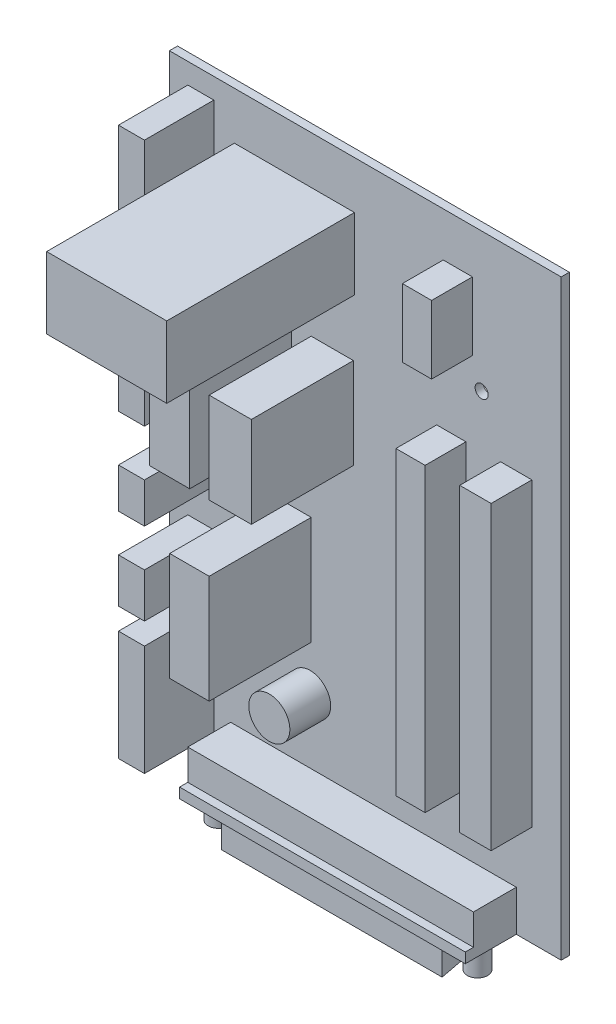
from build123d import *

# Parameters (mm, degrees)
SKETCH_1_W          = 96
SKETCH_1_H          = 145
EXTRUDE_1_DEPTH     = 2
SKETCH_2_W          = 6.362526911
SKETCH_2_H          = 29.426686961
SKETCH_2_H_2        = 22.799054763
SKETCH_2_H_3        = 9.808895654
SKETCH_2_H_4        = 10.869316806
SKETCH_2_H_5        = 27.04073937
EXTRUDE_2_DEPTH     = 17
SKETCH_3_W          = 29.426686961
SKETCH_3_H          = 17.496949003
EXTRUDE_3_DEPTH     = 46
SKETCH_4_W          = 9.808895653
SKETCH_4_H          = 22.268844187
SKETCH_4_W_2        = 10.33910623
SKETCH_4_W_3        = 9.676343009
SKETCH_4_H_2        = 26.510528793
EXTRUDE_4_DEPTH     = 25
SKETCH_5_R          = 5.037000471
EXTRUDE_5_DEPTH     = 10
SKETCH_6_W          = 7.157842775
SKETCH_6_H          = 16.70163314
EXTRUDE_6_DEPTH     = 10
SKETCH_7_W          = 7.157842774
SKETCH_7_H          = 73.699270047
SKETCH_7_W_2        = 7.68805335
EXTRUDE_7_DEPTH     = 10
SKETCH_8_R          = 1.6
CUT_EXTRUDE_1_DEPTH = 99.367931766
SKETCH_9_W          = 70
SKETCH_9_H          = 10
EXTRUDE_8_DEPTH     = 10.5
SKETCH_10_W         = 70
SKETCH_10_H         = 2.5
EXTRUDE_9_DEPTH     = 2
EXTRUDE_10_DEPTH    = 8
SKETCH_12_R         = 2.5
EXTRUDE_11_DEPTH    = 6
M3X0_5_1_D          = 2.5
M3X0_5_1_DEPTH      = 7.5
M3X0_5_1_TIP        = 0.751075774


with BuildPart() as part:
    # 草图1 → 凸台-拉伸1 (new body)
    with BuildSketch(Plane.XY):
        Rectangle(SKETCH_1_W, SKETCH_1_H)
    extrude(amount=EXTRUDE_1_DEPTH)

    # 草图2 → 凸台-拉伸2 (add)
    with BuildSketch(Plane.XY.offset(2)):
        with Locations((-40.296003767, 52.7559523)):
            Rectangle(SKETCH_2_W, SKETCH_2_H)
        with Locations((-40.296003767, 18.159712224)):
            Rectangle(SKETCH_2_W, SKETCH_2_H_2)
        with Locations((-40.296003767, -9.543790366)):
            Rectangle(SKETCH_2_W, SKETCH_2_H_3)
        with Locations((-40.296003767, -29.161581673)):
            Rectangle(SKETCH_2_W, SKETCH_2_H_4)
        with Locations((-40.296003767, -53.418715519)):
            Rectangle(SKETCH_2_W, SKETCH_2_H_5)
    extrude(amount=EXTRUDE_2_DEPTH)

    # 草图3 → 凸台-拉伸3 (add)
    with BuildSketch(Plane.XY.offset(2)):
        with Locations((-17.364396359, 52.09318908)):
            Rectangle(SKETCH_3_W, SKETCH_3_H)
    extrude(amount=EXTRUDE_3_DEPTH)

    # 草图4 → 凸台-拉伸4 (add)
    with BuildSketch(Plane.XY.offset(2)):
        with Locations((-22.931607407, 18.159712224)):
            Rectangle(SKETCH_4_W, SKETCH_4_H)
        with Locations((-8.085711282, 18.159712224)):
            Rectangle(SKETCH_4_W_2, SKETCH_4_H)
        with Locations((-18.093435902, -22.401396831)):
            Rectangle(SKETCH_4_W_3, SKETCH_4_H_2)
    extrude(amount=EXTRUDE_4_DEPTH)

    # 草图5 → 凸台-拉伸5 (add)
    with BuildSketch(Plane.XY.offset(2)):
        with Locations((-13.520369685, -46.791083321)):
            Circle(SKETCH_5_R)
    extrude(amount=EXTRUDE_5_DEPTH)

    # 草图6 → 凸台-拉伸6 (add)
    with BuildSketch(Plane.XY.offset(2)):
        with Locations((22.666502119, 53.286162875)):
            Rectangle(SKETCH_6_W, SKETCH_6_H)
    extrude(amount=EXTRUDE_6_DEPTH)

    # 草图7 → 凸台-拉伸7 (add)
    with BuildSketch(Plane.XY.offset(2)):
        with Locations((21.075870391, -11.00186945)):
            Rectangle(SKETCH_7_W, SKETCH_7_H)
        with Locations((36.982187667, -11.00186945)):
            Rectangle(SKETCH_7_W_2, SKETCH_7_H)
    extrude(amount=EXTRUDE_7_DEPTH)

    # 草图8 → 切除-拉伸1 (cut, through all)
    with BuildSketch(Plane.XY.offset(2)):
        with Locations((-31.5, -51.5)):
            Circle(SKETCH_8_R)
        with Locations((28.5, -51.5)):
            Circle(SKETCH_8_R)
        with Locations((-31.5, 38.5)):
            Circle(SKETCH_8_R)
        with Locations((28.5, 38.5)):
            Circle(SKETCH_8_R)
    extrude(amount=-CUT_EXTRUDE_1_DEPTH, mode=Mode.SUBTRACT)

    # 草图9 → 凸台-拉伸8 (add)
    with BuildSketch(Plane.XY.offset(2)):
        with Locations((2, -67.5)):
            Rectangle(SKETCH_9_W, SKETCH_9_H)
    extrude(amount=EXTRUDE_8_DEPTH)

    # 草图10 → 凸台-拉伸9 (add)
    with BuildSketch(Plane.XY.offset(12.5)):
        with Locations((2, -71.25)):
            Rectangle(SKETCH_10_W, SKETCH_10_H)
    extrude(amount=EXTRUDE_9_DEPTH)

    # 草图11 → 凸台-拉伸10 (add)
    with BuildSketch(Plane.XZ.offset(72.5)):
        Polygon((-25, 12.175), (29, 12.175), (27.5, 4.325), (-23.5, 4.325), align=None)
    extrude(amount=EXTRUDE_10_DEPTH)

    # 草图12 → 凸台-拉伸11 (add)
    with BuildSketch(Plane.XZ.offset(72.5)):
        with Locations(Location((-29.75, 8.25, 0), (0, 0, 90))):
            Circle(SKETCH_12_R)
        with Locations(Location((33.75, 8.25, 0), (0, 0, 90))):
            Circle(SKETCH_12_R)
    extrude(amount=EXTRUDE_11_DEPTH)

    # M3x0.5 螺纹孔1
    with Locations(Plane.XZ.offset(78.5)):
        with Locations((-29.75, 8.25), (33.75, 8.25)):
            Hole(M3X0_5_1_D / 2, depth=M3X0_5_1_DEPTH)
            with Locations((0, 0, -(M3X0_5_1_DEPTH + M3X0_5_1_TIP / 2))):  # 118° drill point
                Cone(0, M3X0_5_1_D / 2, M3X0_5_1_TIP, mode=Mode.SUBTRACT)


solid = part.part
